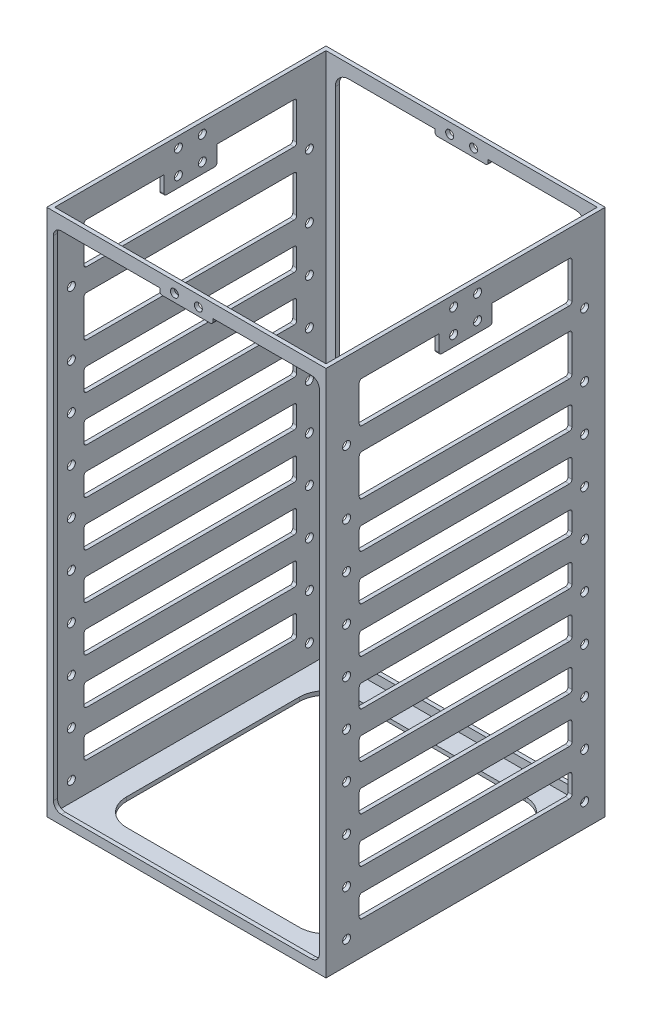
from build123d import *

# Parameters (mm, degrees)
SKETCH1_W           = 105
SKETCH1_H           = 105
BOSS_EXTRUDE2_DEPTH = 1.5
SKETCH3_W           = 105
SKETCH3_H           = 105
SKETCH3_W_2         = 102
SKETCH3_H_2         = 102
BOSS_EXTRUDE3_DEPTH = 197
CUT_EXTRUDE1_DEPTH  = 1.5
SKETCH6_R           = 1.5
CUT_EXTRUDE2_DEPTH  = 231.615480833
CUT_EXTRUDE3_DEPTH  = 1.5
CUT_EXTRUDE4_DEPTH  = 231.615480833
CUT_EXTRUDE5_DEPTH  = 231.615480833
BOSS_EXTRUDE4_DEPTH = 1.5
BOSS_EXTRUDE5_START = -1.5
BOSS_EXTRUDE5_DEPTH = 1.5
SKETCH9_R           = 1.5
CUT_EXTRUDE6_DEPTH  = 231.615480833
BOSS_EXTRUDE6_DEPTH = 1.5
BOSS_EXTRUDE7_START = -1.5
BOSS_EXTRUDE7_DEPTH = 1.5
SKETCH19_R          = 1.5
CUT_EXTRUDE7_DEPTH  = 231.615480833


with BuildPart() as part:
    # Sketch1 → Boss-Extrude2 (new body)
    with BuildSketch(Plane(origin=(0, 0, 0), x_dir=(1, 0, 0), z_dir=(0, 1, 0))):
        Rectangle(SKETCH1_W, SKETCH1_H)
        with BuildLine():
            Line((-32.5, -42.5), (32.5, -42.5))
            ThreePointArc((32.5, -42.5), (39.571067812, -39.571067812), (42.5, -32.5))
            Line((42.5, -32.5), (42.5, 32.5))
            ThreePointArc((42.5, 32.5), (39.571067812, 39.571067812), (32.5, 42.5))
            Line((32.5, 42.5), (-32.5, 42.5))
            ThreePointArc((-32.5, 42.5), (-39.571067812, 39.571067812), (-42.5, 32.5))
            Line((-42.5, 32.5), (-42.5, -32.5))
            ThreePointArc((-42.5, -32.5), (-39.571067812, -39.571067812), (-32.5, -42.5))
        make_face(mode=Mode.SUBTRACT)
    extrude(amount=BOSS_EXTRUDE2_DEPTH)

    # Sketch3 → Boss-Extrude3 (add)
    with BuildSketch(Plane(origin=(0, 1.5, 0), x_dir=(1, 0, 0), z_dir=(0, 1, 0))):
        Rectangle(SKETCH3_W, SKETCH3_H)
        Rectangle(SKETCH3_W_2, SKETCH3_H_2, mode=Mode.SUBTRACT)
    extrude(amount=BOSS_EXTRUDE3_DEPTH)

    # Sketch4 → Cut-Extrude1 (cut)
    with BuildSketch(Plane.XY.offset(-52.5)):
        with BuildLine():
            Line((-42.5, 5), (42.5, 5))
            ThreePointArc((42.5, 5), (46.035533906, 6.464466094), (47.5, 10))
            Line((47.5, 10), (47.5, 188.5))
            ThreePointArc((47.5, 188.5), (46.035533906, 192.035533906), (42.5, 193.5))
            Line((42.5, 193.5), (-42.5, 193.5))
            ThreePointArc((-42.5, 193.5), (-46.035533906, 192.035533906), (-47.5, 188.5))
            Line((-47.5, 188.5), (-47.5, 10))
            ThreePointArc((-47.5, 10), (-46.035533906, 6.464466094), (-42.5, 5))
        make_face()
    extrude(amount=CUT_EXTRUDE1_DEPTH, mode=Mode.SUBTRACT)

    # Sketch6 → Cut-Extrude2 (cut, through all)
    with BuildSketch(Plane(origin=(52.5, 0, 0), x_dir=(0, 0, -1), z_dir=(1, 0, 0))):
        with Locations((-44.75, 8.75)):
            Circle(SKETCH6_R)
        with Locations((44.75, 8.75)):
            Circle(SKETCH6_R)
        with Locations((-44.75, 25.85)):
            Circle(SKETCH6_R)
        with Locations((44.75, 25.85)):
            Circle(SKETCH6_R)
        with Locations((-44.75, 42.95)):
            Circle(SKETCH6_R)
        with Locations((44.75, 42.95)):
            Circle(SKETCH6_R)
        with Locations((-44.75, 60.05)):
            Circle(SKETCH6_R)
        with Locations((44.75, 60.05)):
            Circle(SKETCH6_R)
        with Locations((-44.75, 77.15)):
            Circle(SKETCH6_R)
        with Locations((44.75, 77.15)):
            Circle(SKETCH6_R)
        with Locations((-44.75, 94.25)):
            Circle(SKETCH6_R)
        with Locations((44.75, 94.25)):
            Circle(SKETCH6_R)
        with Locations((-44.75, 111.35)):
            Circle(SKETCH6_R)
        with Locations((44.75, 111.35)):
            Circle(SKETCH6_R)
        with Locations((-44.75, 128.45)):
            Circle(SKETCH6_R)
        with Locations((44.75, 128.45)):
            Circle(SKETCH6_R)
        with Locations((-44.75, 145.55)):
            Circle(SKETCH6_R)
        with Locations((44.75, 145.55)):
            Circle(SKETCH6_R)
        with Locations((-44.75, 169.55)):
            Circle(SKETCH6_R)
        with Locations((44.75, 169.55)):
            Circle(SKETCH6_R)
    extrude(amount=-CUT_EXTRUDE2_DEPTH, mode=Mode.SUBTRACT)

    # Sketch5 → Cut-Extrude3 (cut)
    with BuildSketch(Plane.XY.offset(52.5)):
        with BuildLine():
            Line((-47, 3.5), (47, 3.5))
            ThreePointArc((47, 3.5), (49.121320344, 4.378679656), (50, 6.5))
            Line((50, 6.5), (50, 190.5))
            ThreePointArc((50, 190.5), (49.121320344, 192.621320344), (47, 193.5))
            Line((47, 193.5), (-47, 193.5))
            ThreePointArc((-47, 193.5), (-49.121320344, 192.621320344), (-50, 190.5))
            Line((-50, 190.5), (-50, 6.5))
            ThreePointArc((-50, 6.5), (-49.121320344, 4.378679656), (-47, 3.5))
        make_face()
    extrude(amount=-CUT_EXTRUDE3_DEPTH, mode=Mode.SUBTRACT)

    # Sketch7 → Cut-Extrude4 (cut, through all)
    with BuildSketch(Plane(origin=(52.5, 0, 0), x_dir=(0, 0, -1), z_dir=(1, 0, 0))):
        with BuildLine():
            Line((-40, 30.65), (-40, 37.15))
            ThreePointArc((-40, 37.15), (-39.707106781, 37.857106781), (-39, 38.15))
            Line((-39, 38.15), (39, 38.15))
            ThreePointArc((39, 38.15), (39.707106781, 37.857106781), (40, 37.15))
            Line((40, 37.15), (40, 30.65))
            ThreePointArc((40, 30.65), (39.707106781, 29.942893219), (39, 29.65))
            Line((39, 29.65), (-39, 29.65))
            ThreePointArc((-39, 29.65), (-39.707106781, 29.942893219), (-40, 30.65))
        make_face()
        with BuildLine():
            Line((-39, 12.55), (39, 12.55))
            ThreePointArc((39, 12.55), (39.707106781, 12.842893219), (40, 13.55))
            Line((40, 13.55), (40, 20.05))
            ThreePointArc((40, 20.05), (39.707106781, 20.757106781), (39, 21.05))
            Line((39, 21.05), (-39, 21.05))
            ThreePointArc((-39, 21.05), (-39.707106781, 20.757106781), (-40, 20.05))
            Line((-40, 20.05), (-40, 13.55))
            ThreePointArc((-40, 13.55), (-39.707106781, 12.842893219), (-39, 12.55))
        make_face()
        with BuildLine():
            Line((-40, 47.75), (-40, 54.25))
            ThreePointArc((-40, 54.25), (-39.707106781, 54.957106781), (-39, 55.25))
            Line((-39, 55.25), (39, 55.25))
            ThreePointArc((39, 55.25), (39.707106781, 54.957106781), (40, 54.25))
            Line((40, 54.25), (40, 47.75))
            ThreePointArc((40, 47.75), (39.707106781, 47.042893219), (39, 46.75))
            Line((39, 46.75), (-39, 46.75))
            ThreePointArc((-39, 46.75), (-39.707106781, 47.042893219), (-40, 47.75))
        make_face()
        with BuildLine():
            Line((-40, 64.85), (-40, 71.35))
            ThreePointArc((-40, 71.35), (-39.707106781, 72.057106781), (-39, 72.35))
            Line((-39, 72.35), (39, 72.35))
            ThreePointArc((39, 72.35), (39.707106781, 72.057106781), (40, 71.35))
            Line((40, 71.35), (40, 64.85))
            ThreePointArc((40, 64.85), (39.707106781, 64.142893219), (39, 63.85))
            Line((39, 63.85), (-39, 63.85))
            ThreePointArc((-39, 63.85), (-39.707106781, 64.142893219), (-40, 64.85))
        make_face()
        with BuildLine():
            Line((-40, 81.95), (-40, 88.45))
            ThreePointArc((-40, 88.45), (-39.707106781, 89.157106781), (-39, 89.45))
            Line((-39, 89.45), (39, 89.45))
            ThreePointArc((39, 89.45), (39.707106781, 89.157106781), (40, 88.45))
            Line((40, 88.45), (40, 81.95))
            ThreePointArc((40, 81.95), (39.707106781, 81.242893219), (39, 80.95))
            Line((39, 80.95), (-39, 80.95))
            ThreePointArc((-39, 80.95), (-39.707106781, 81.242893219), (-40, 81.95))
        make_face()
        with BuildLine():
            Line((-40, 99.05), (-40, 105.55))
            ThreePointArc((-40, 105.55), (-39.707106781, 106.257106781), (-39, 106.55))
            Line((-39, 106.55), (39, 106.55))
            ThreePointArc((39, 106.55), (39.707106781, 106.257106781), (40, 105.55))
            Line((40, 105.55), (40, 99.05))
            ThreePointArc((40, 99.05), (39.707106781, 98.342893219), (39, 98.05))
            Line((39, 98.05), (-39, 98.05))
            ThreePointArc((-39, 98.05), (-39.707106781, 98.342893219), (-40, 99.05))
        make_face()
        with BuildLine():
            Line((-40, 116.15), (-40, 122.65))
            ThreePointArc((-40, 122.65), (-39.707106781, 123.357106781), (-39, 123.65))
            Line((-39, 123.65), (39, 123.65))
            ThreePointArc((39, 123.65), (39.707106781, 123.357106781), (40, 122.65))
            Line((40, 122.65), (40, 116.15))
            ThreePointArc((40, 116.15), (39.707106781, 115.442893219), (39, 115.15))
            Line((39, 115.15), (-39, 115.15))
            ThreePointArc((-39, 115.15), (-39.707106781, 115.442893219), (-40, 116.15))
        make_face()
        with BuildLine():
            Line((-40, 133.25), (-40, 139.75))
            ThreePointArc((-40, 139.75), (-39.707106781, 140.457106781), (-39, 140.75))
            Line((-39, 140.75), (39, 140.75))
            ThreePointArc((39, 140.75), (39.707106781, 140.457106781), (40, 139.75))
            Line((40, 139.75), (40, 133.25))
            ThreePointArc((40, 133.25), (39.707106781, 132.542893219), (39, 132.25))
            Line((39, 132.25), (-39, 132.25))
            ThreePointArc((-39, 132.25), (-39.707106781, 132.542893219), (-40, 133.25))
        make_face()
    extrude(amount=-CUT_EXTRUDE4_DEPTH, mode=Mode.SUBTRACT)

    # Sketch8 → Cut-Extrude5 (cut, through all)
    with BuildSketch(Plane(origin=(52.5, 0, 0), x_dir=(0, 0, -1), z_dir=(1, 0, 0))):
        with BuildLine():
            Line((-39, 149.35), (39, 149.35))
            ThreePointArc((39, 149.35), (39.707106781, 149.642893219), (40, 150.35))
            Line((40, 150.35), (40, 163.75))
            ThreePointArc((40, 163.75), (39.707106781, 164.457106781), (39, 164.75))
            Line((39, 164.75), (-39, 164.75))
            ThreePointArc((-39, 164.75), (-39.707106781, 164.457106781), (-40, 163.75))
            Line((-40, 163.75), (-40, 150.35))
            ThreePointArc((-40, 150.35), (-39.707106781, 149.642893219), (-39, 149.35))
        make_face()
        with BuildLine():
            Line((-40, 174.15), (-40, 187.55))
            ThreePointArc((-40, 187.55), (-39.707106781, 188.257106781), (-39, 188.55))
            Line((-39, 188.55), (39, 188.55))
            ThreePointArc((39, 188.55), (39.707106781, 188.257106781), (40, 187.55))
            Line((40, 187.55), (40, 174.15))
            ThreePointArc((40, 174.15), (39.707106781, 173.442893219), (39, 173.15))
            Line((39, 173.15), (-39, 173.15))
            ThreePointArc((-39, 173.15), (-39.707106781, 173.442893219), (-40, 174.15))
        make_face()
    extrude(amount=-CUT_EXTRUDE5_DEPTH, mode=Mode.SUBTRACT)

    # Sketch15 → Boss-Extrude4 (add)
    with BuildSketch(Plane(origin=(52.5, 0, 0), x_dir=(0, 0, -1), z_dir=(1, 0, 0))):
        with BuildLine():
            Line((-10, 188.55), (10, 188.55))
            Line((10, 188.55), (10, 182.55))
            ThreePointArc((10, 182.55), (9.707106781, 181.842893219), (9, 181.55))
            Line((9, 181.55), (-9, 181.55))
            ThreePointArc((-9, 181.55), (-9.707106781, 181.842893219), (-10, 182.55))
            Line((-10, 182.55), (-10, 188.55))
        make_face()
    extrude(amount=-BOSS_EXTRUDE4_DEPTH)

    # Sketch16 → Boss-Extrude5 (add)
    with BuildSketch(Plane.ZY.offset(52.5).offset(BOSS_EXTRUDE5_START)):
        with BuildLine():
            Line((-10, 188.55), (10, 188.55))
            Line((10, 188.55), (10, 182.55))
            ThreePointArc((10, 182.55), (9.707106781, 181.842893219), (9, 181.55))
            Line((9, 181.55), (-9, 181.55))
            ThreePointArc((-9, 181.55), (-9.707106781, 181.842893219), (-10, 182.55))
            Line((-10, 182.55), (-10, 188.55))
        make_face()
    extrude(amount=BOSS_EXTRUDE5_DEPTH)

    # Sketch9 → Cut-Extrude6 (cut, through all)
    with BuildSketch(Plane(origin=(52.5, 0, 0), x_dir=(0, 0, -1), z_dir=(1, 0, 0))):
        with Locations((-4.5, 194.5)):
            Circle(SKETCH9_R)
        with Locations((4.5, 194.5)):
            Circle(SKETCH9_R)
        with Locations(Location((4.5, 185.5, 0), (0, 0, 180))):
            Circle(SKETCH9_R)
        with Locations(Location((-4.5, 185.5, 0), (0, 0, 180))):
            Circle(SKETCH9_R)
    extrude(amount=-CUT_EXTRUDE6_DEPTH, mode=Mode.SUBTRACT)

    # Sketch17 → Boss-Extrude6 (add)
    with BuildSketch(Plane.XY.offset(52.5)):
        with BuildLine():
            Line((-10, 193.5), (10, 193.5))
            Line((10, 193.5), (10, 192.5))
            ThreePointArc((10, 192.5), (9.707106781, 191.792893219), (9, 191.5))
            Line((9, 191.5), (-9, 191.5))
            ThreePointArc((-9, 191.5), (-9.707106781, 191.792893219), (-10, 192.5))
            Line((-10, 192.5), (-10, 193.5))
        make_face()
    extrude(amount=-BOSS_EXTRUDE6_DEPTH)

    # Sketch18 → Boss-Extrude7 (add)
    with BuildSketch(Plane(origin=(0, 0, -52.5), x_dir=(-1, 0, 0), z_dir=(0, 0, -1)).offset(BOSS_EXTRUDE7_START)):
        with BuildLine():
            Line((-10, 193.5), (10, 193.5))
            Line((10, 193.5), (10, 192.5))
            ThreePointArc((10, 192.5), (9.707106781, 191.792893219), (9, 191.5))
            Line((9, 191.5), (-9, 191.5))
            ThreePointArc((-9, 191.5), (-9.707106781, 191.792893219), (-10, 192.5))
            Line((-10, 192.5), (-10, 193.5))
        make_face()
    extrude(amount=BOSS_EXTRUDE7_DEPTH)

    # Sketch19 → Cut-Extrude7 (cut, through all)
    with BuildSketch(Plane.XY.offset(52.5)):
        with Locations((-4.5, 194.5)):
            Circle(SKETCH19_R)
        with Locations(Location((4.5, 194.5, 0), (0, 0, 180))):
            Circle(SKETCH19_R)
    extrude(amount=-CUT_EXTRUDE7_DEPTH, mode=Mode.SUBTRACT)


solid = part.part
